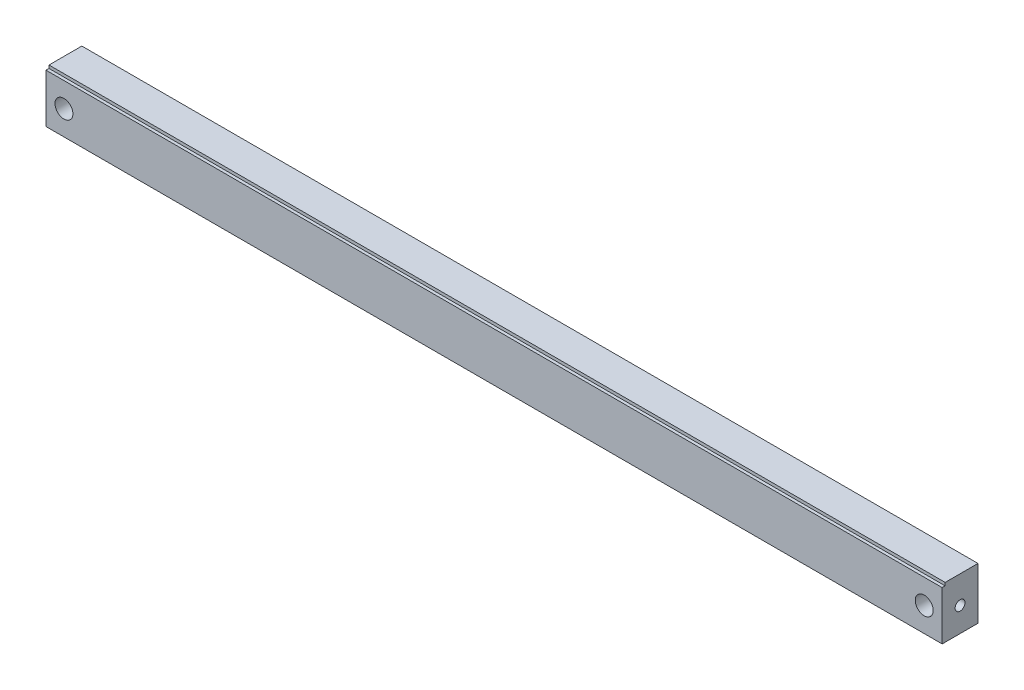
from build123d import *

# Parameters (mm, degrees)
SKETCH_1_W          = 300
SKETCH_1_H          = 12
EXTRUDE_320_DEPTH   = 17.35
SKETCH_2_W          = 300
SKETCH_2_H          = 1
CUT_EXTRUDE_1_DEPTH = 1
SKETCH_5_R          = 3
CUT_EXTRUDE_6_DEPTH = 152.476144987


with BuildPart() as part:
    # Эскиз1 → Extrude 320 (new body)
    with BuildSketch(Plane(origin=(0, 0, 0), x_dir=(1, 0, 0), z_dir=(0, 1, 0))):
        with Locations((0, 6)):
            Rectangle(SKETCH_1_W, SKETCH_1_H)
    extrude(amount=EXTRUDE_320_DEPTH)

    # Эскиз2 → Вырез-Вытянуть1 (cut)
    with BuildSketch(Plane(origin=(0, 17.35, 0), x_dir=(1, 0, 0), z_dir=(0, 1, 0))):
        with Locations((0, 0.5)):
            Rectangle(SKETCH_2_W, SKETCH_2_H)
    extrude(amount=-CUT_EXTRUDE_1_DEPTH, mode=Mode.SUBTRACT)

    # Эскиз5 → Валы-6мм (cut, through all)
    with BuildSketch(Plane.XY):
        with Locations((-144, 8.175)):
            Circle(SKETCH_5_R)
        with Locations((144, 8.175)):
            Circle(SKETCH_5_R)
    extrude(amount=-CUT_EXTRUDE_6_DEPTH, mode=Mode.SUBTRACT)

    # Эскиз10 → Фиксация-M4 (revolve, cut)
    with BuildSketch(Plane(origin=(150, 8.175, -6), x_dir=(0, 0, -1), z_dir=(0, 1, 0))):
        Polygon((0, 0), (0, 10.991420021), (1.65, 10), (1.65, 0), align=None)
    hole_wizard_m4 = revolve(axis=Axis((156.35, 8.175, -6), (-1, 0, 0)), mode=Mode.SUBTRACT)

    # Зеркальное отражение1: Фиксация-M4 across plane
    add(hole_wizard_m4.mirror(Plane(origin=(0, 0, 0), x_dir=(0, 0, 1), z_dir=(1, 0, 0))), mode=Mode.SUBTRACT)


solid = part.part
